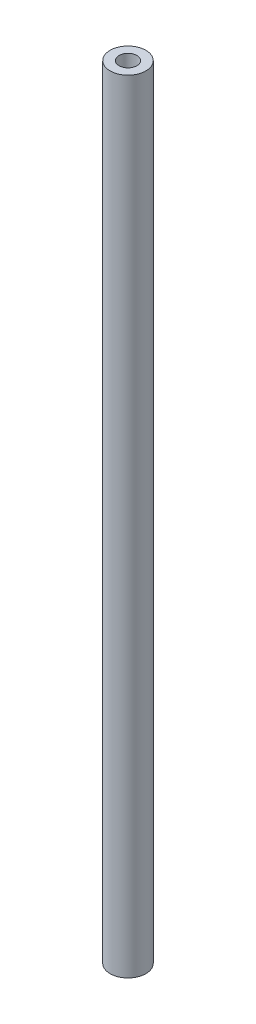
from build123d import *

# Parameters (mm, degrees)
SKETCH1_R           = 4
BOSS_EXTRUDE1_DEPTH = 175
SKETCH2_R           = 2
CUT_EXTRUDE1_DEPTH  = 30


with BuildPart() as part:
    # Sketch1 → Boss-Extrude1 (new body)
    with BuildSketch(Plane(origin=(0, 0, 0), x_dir=(1, 0, 0), z_dir=(0, 1, 0))):
        with Locations(Location((0, 0, 0), (0, 0, 270))):
            Circle(SKETCH1_R)
    extrude(amount=BOSS_EXTRUDE1_DEPTH)

    # Sketch2 → Cut-Extrude1 (cut)
    with BuildSketch(Plane.XZ):
        with Locations(Location((0, 0, 0), (0, 0, 270))):
            Circle(SKETCH2_R)
    cut_extrude1 = extrude(amount=-CUT_EXTRUDE1_DEPTH, mode=Mode.SUBTRACT)

    # Mirror1: Cut-Extrude1 across plane
    add(cut_extrude1.mirror(Plane(origin=(0, 87.5, 0), x_dir=(0, 0, 1), z_dir=(0, -1, 0))), mode=Mode.SUBTRACT)


solid = part.part
